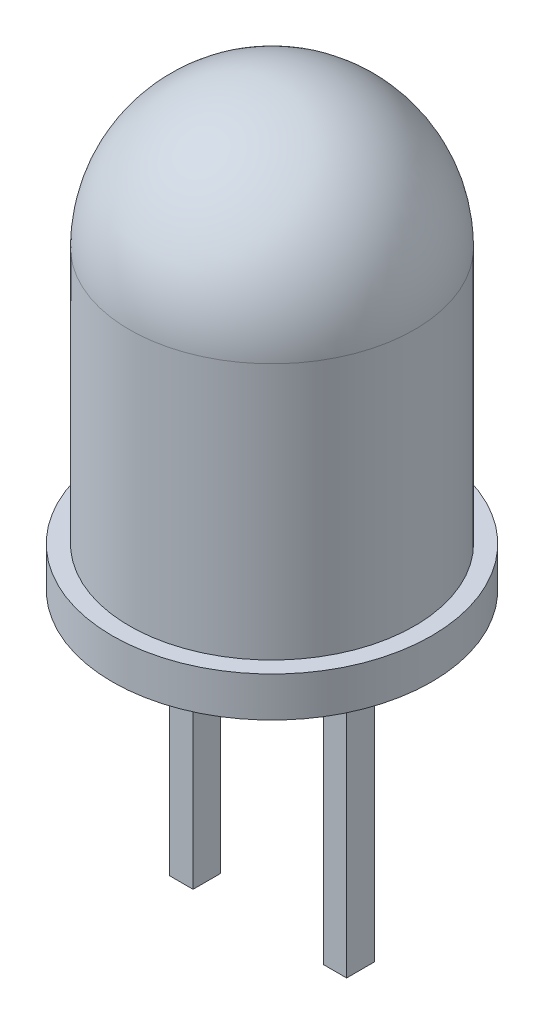
from build123d import *

# Parameters (mm, degrees)
SKETCH2_R           = 2.5
BOSS_EXTRUDE1_DEPTH = 7
SKETCH3_R           = 2.8
BOSS_EXTRUDE2_DEPTH = 0.7
FILLET1_R           = 2.5
SKETCH4_W           = 0.409361502
SKETCH4_H           = 0.4847702
BOSS_EXTRUDE3_DEPTH = 5


with BuildPart() as part:
    # Sketch2 → Boss-Extrude1 (new body)
    with BuildSketch(Plane(origin=(0, 0, 0), x_dir=(1, 0, 0), z_dir=(0, 1, 0))):
        with Locations(Location((0, 0, 0), (0, 0, 270))):
            Circle(SKETCH2_R)
    extrude(amount=BOSS_EXTRUDE1_DEPTH)

    # Sketch3 → Boss-Extrude2 (add)
    with BuildSketch(Plane.XZ):
        with Locations(Location((0, 0, 0), (0, 0, 270))):
            Circle(SKETCH3_R)
    extrude(amount=BOSS_EXTRUDE2_DEPTH)

    # Fillet1
    fillet1_edges = [part.edges().sort_by_distance(p)[0] for p in [
        (0, 7, -2.5),
    ]]
    fillet(fillet1_edges, radius=FILLET1_R)

    # Sketch4 → Boss-Extrude3 (add)
    with BuildSketch(Plane.XZ.offset(0.7)):
        with Locations((1.346583888, 0)):
            Rectangle(SKETCH4_W, SKETCH4_H)
        with Locations((-1.346583888, 0)):
            Rectangle(SKETCH4_W, SKETCH4_H)
    extrude(amount=BOSS_EXTRUDE3_DEPTH)


solid = part.part
